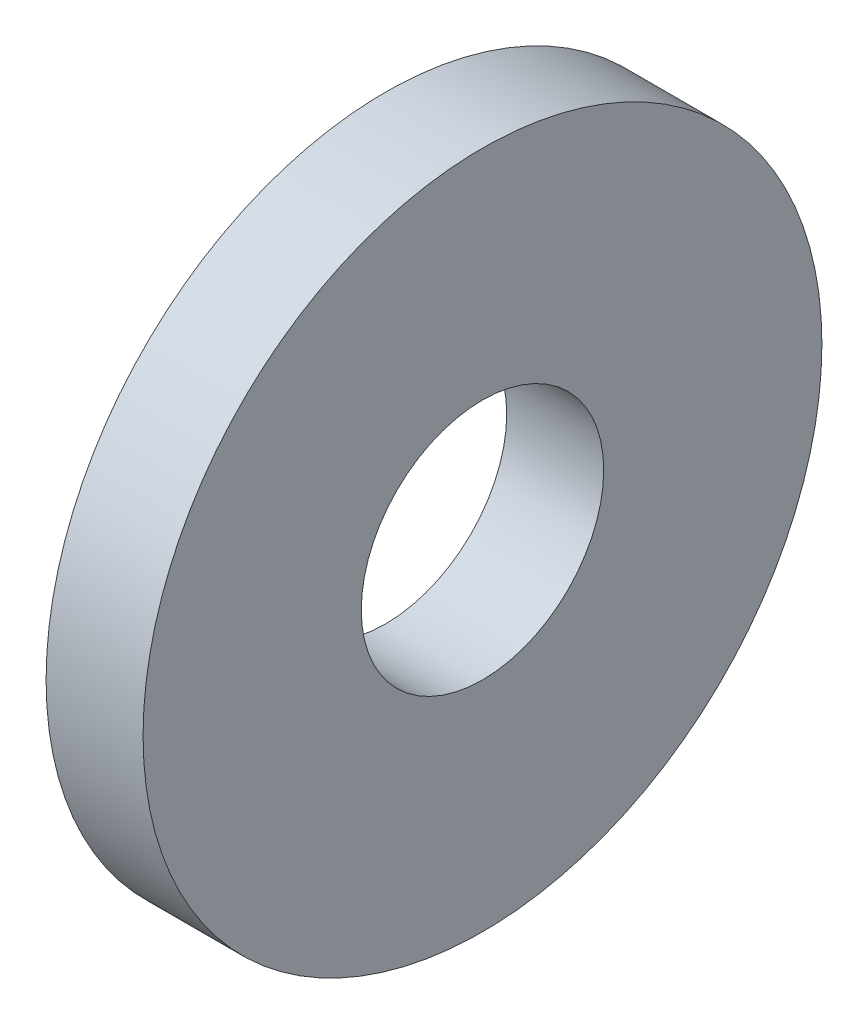
from build123d import *

# Parameters (mm, degrees)
SKETCH1_R          = 3.5
SKETCH1_R_2        = 1.25
BASE_EXTRUDE_DEPTH = 1


with BuildPart() as part:
    # Sketch1 → Base-Extrude (new body)
    with BuildSketch(Plane(origin=(0, 0, 0), x_dir=(0, 0, -1), z_dir=(1, 0, 0))):
        Circle(SKETCH1_R)
        Circle(SKETCH1_R_2, mode=Mode.SUBTRACT)
    extrude(amount=BASE_EXTRUDE_DEPTH)


solid = part.part
